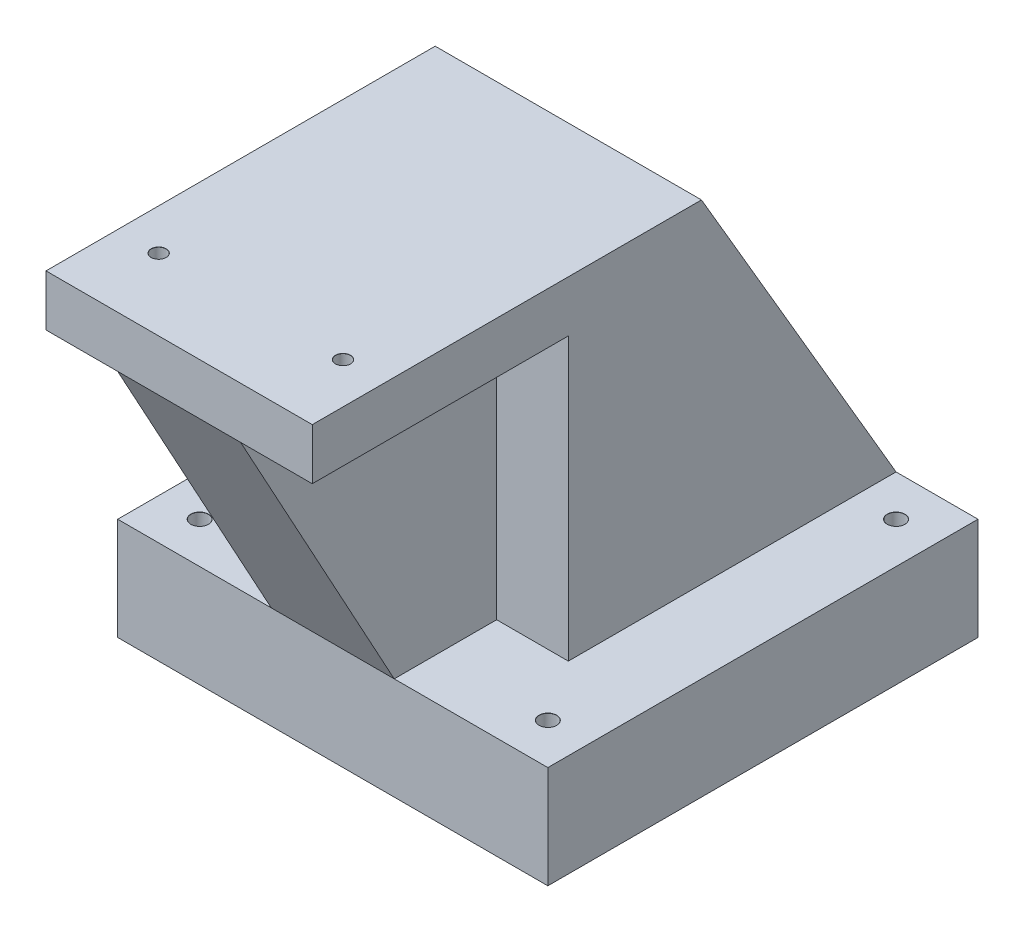
from build123d import *

# Parameters (mm, degrees)
SKETCH1_W                        = 84
SKETCH1_H                        = 84
BOSS_EXTRUDE1_DEPTH              = 20
M3_CLEARANCE_HOLE1_D             = 3.4
M3_CLEARANCE_HOLE1_CSINK_D       = 3.45
M3_CLEARANCE_HOLE1_CSINK_ANGLE   = 90
BOSS_EXTRUDE2_DEPTH              = 65
BOSS_EXTRUDE3_DEPTH              = 10
M2_5_CLEARANCE_HOLE2_D           = 2.9
M2_5_CLEARANCE_HOLE2_DEPTH       = 10
M2_5_CLEARANCE_HOLE2_CSINK_D     = 2.95
M2_5_CLEARANCE_HOLE2_CSINK_ANGLE = 90
M2_5_CLEARANCE_HOLE2_TIP         = 0.871247898
SKETCH16_W                       = 30
SKETCH16_H                       = 55
CUT_EXTRUDE2_DEPTH               = 50
CUT_EXTRUDE3_DEPTH               = 124.794184031
CUT_EXTRUDE4_DEPTH               = 230
SKETCH19_W                       = 16
SKETCH19_H                       = 65
CUT_EXTRUDE5_DEPTH               = 230


with BuildPart() as part:
    # Sketch1 → Boss-Extrude1 (new body)
    with BuildSketch(Plane(origin=(0, 0, 0), x_dir=(1, 0, 0), z_dir=(0, 1, 0))):
        Rectangle(SKETCH1_W, SKETCH1_H)
    extrude(amount=BOSS_EXTRUDE1_DEPTH)

    # M3 Clearance Hole1 (through all)
    with Locations(Plane(origin=(0, 20, 0), x_dir=(1, 0, 0), z_dir=(0, 1, 0))):
        with Locations((-34, 34), (34, 34), (34, -34), (-34, -34)):
            CounterSinkHole(M3_CLEARANCE_HOLE1_D / 2, M3_CLEARANCE_HOLE1_CSINK_D / 2, counter_sink_angle=M3_CLEARANCE_HOLE1_CSINK_ANGLE)

    # Sketch5 → Boss-Extrude2 (add)
    with BuildSketch(Plane(origin=(0, 20, 0), x_dir=(1, 0, 0), z_dir=(0, 1, 0))):
        Polygon((-42, 4), (-26, 4), (-26, 42), (26, 42), (26, 4), (42, 4), (42, -72), (-42, -72), align=None)
    extrude(amount=BOSS_EXTRUDE2_DEPTH)

    # Sketch7 → Boss-Extrude3 (add)
    with BuildSketch(Plane(origin=(0, 85, 0), x_dir=(1, 0, 0), z_dir=(0, 1, 0))):
        Polygon((-42, 3), (-42, -42), (42, -42), (42, 3), (37.817930688, 3), (0, 3), (-37.817930688, 3), align=None)
    extrude(amount=-BOSS_EXTRUDE3_DEPTH)

    # M2.5 Clearance Hole2
    with Locations(Plane(origin=(0, 85, 0), x_dir=(1, 0, 0), z_dir=(0, 1, 0))):
        with Locations((-18, -58), (18, -58)):
            CounterSinkHole(M2_5_CLEARANCE_HOLE2_D / 2, M2_5_CLEARANCE_HOLE2_CSINK_D / 2, depth=M2_5_CLEARANCE_HOLE2_DEPTH, counter_sink_angle=M2_5_CLEARANCE_HOLE2_CSINK_ANGLE)
            with Locations((0, 0, -(M2_5_CLEARANCE_HOLE2_DEPTH + M2_5_CLEARANCE_HOLE2_TIP / 2))):  # 118° drill point
                Cone(0, M2_5_CLEARANCE_HOLE2_D / 2, M2_5_CLEARANCE_HOLE2_TIP, mode=Mode.SUBTRACT)

    # Sketch16 → Cut-Extrude2 (cut)
    with BuildSketch(Plane.XY.offset(72)):
        with Locations((27, 47.5)):
            Rectangle(SKETCH16_W, SKETCH16_H)
        with Locations((-27, 47.5)):
            Rectangle(SKETCH16_W, SKETCH16_H)
    extrude(amount=-CUT_EXTRUDE2_DEPTH, mode=Mode.SUBTRACT)

    # Sketch17 → Cut-Extrude3 (cut, through all)
    with BuildSketch(Plane(origin=(12, 0, 0), x_dir=(0, 0, -1), z_dir=(1, 0, 0))):
        Polygon((-42, 20), (-72, 75), (-72, 20), align=None)
    extrude(amount=-CUT_EXTRUDE3_DEPTH, mode=Mode.SUBTRACT)

    # Sketch18 → Cut-Extrude4 (cut)
    with BuildSketch(Plane(origin=(26, 0, 0), x_dir=(0, 0, -1), z_dir=(1, 0, 0))):
        Polygon((4, 85), (42, 20), (42, 85), align=None)
    extrude(amount=-CUT_EXTRUDE4_DEPTH, mode=Mode.SUBTRACT)

    # Sketch19 → Cut-Extrude5 (cut)
    with BuildSketch(Plane(origin=(0, 0, -4), x_dir=(-1, 0, 0), z_dir=(0, 0, -1))):
        with Locations((-34, 52.5)):
            Rectangle(SKETCH19_W, SKETCH19_H)
        with Locations((34, 52.5)):
            Rectangle(SKETCH19_W, SKETCH19_H)
    extrude(amount=-CUT_EXTRUDE5_DEPTH, mode=Mode.SUBTRACT)


solid = part.part
